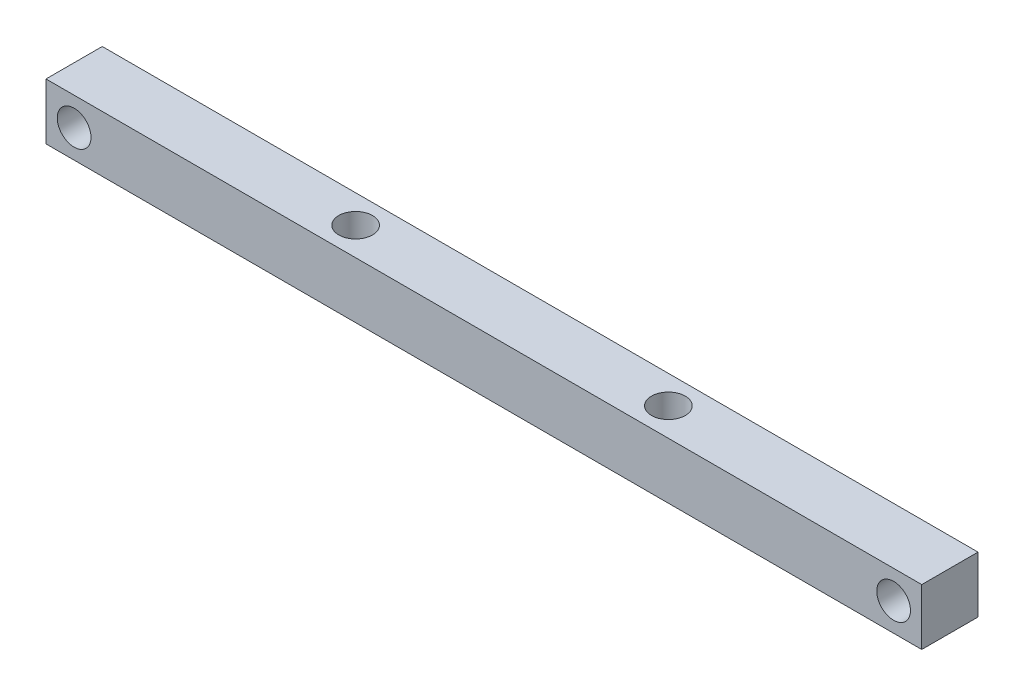
from build123d import *

# Parameters (mm, degrees)
SKETCH1_W           = 98.8568
SKETCH1_H           = 6.35
BOSS_EXTRUDE1_DEPTH = 6.35
SKETCH2_R           = 1.905
CUT_EXTRUDE1_DEPTH  = 116.667416004
SKETCH3_R           = 1.905
CUT_EXTRUDE2_DEPTH  = 105.09694142


with BuildPart() as part:
    # Sketch1 → Boss-Extrude1 (new body)
    with BuildSketch(Plane.XY):
        with Locations((-54.280462751, 47.649210884)):
            Rectangle(SKETCH1_W, SKETCH1_H)
    extrude(amount=BOSS_EXTRUDE1_DEPTH)

    # Sketch2 → Cut-Extrude1 (cut, through all)
    with BuildSketch(Plane.XY.offset(6.35)):
        with Locations((-100.533862751, 47.649210884)):
            Circle(SKETCH2_R)
        with Locations((-8.027062751, 47.649210884)):
            Circle(SKETCH2_R)
    extrude(amount=-CUT_EXTRUDE1_DEPTH, mode=Mode.SUBTRACT)

    # Sketch3 → Cut-Extrude2 (cut, through all)
    with BuildSketch(Plane(origin=(0, 50.824210884, 0), x_dir=(1, 0, 0), z_dir=(0, 1, 0))):
        with Locations(Location((-71.933462751, -3.175, 0), (0, 0, 270))):
            Circle(SKETCH3_R)
        with Locations(Location((-36.627462751, -3.175, 0), (0, 0, 270))):
            Circle(SKETCH3_R)
    extrude(amount=-CUT_EXTRUDE2_DEPTH, mode=Mode.SUBTRACT)


solid = part.part
